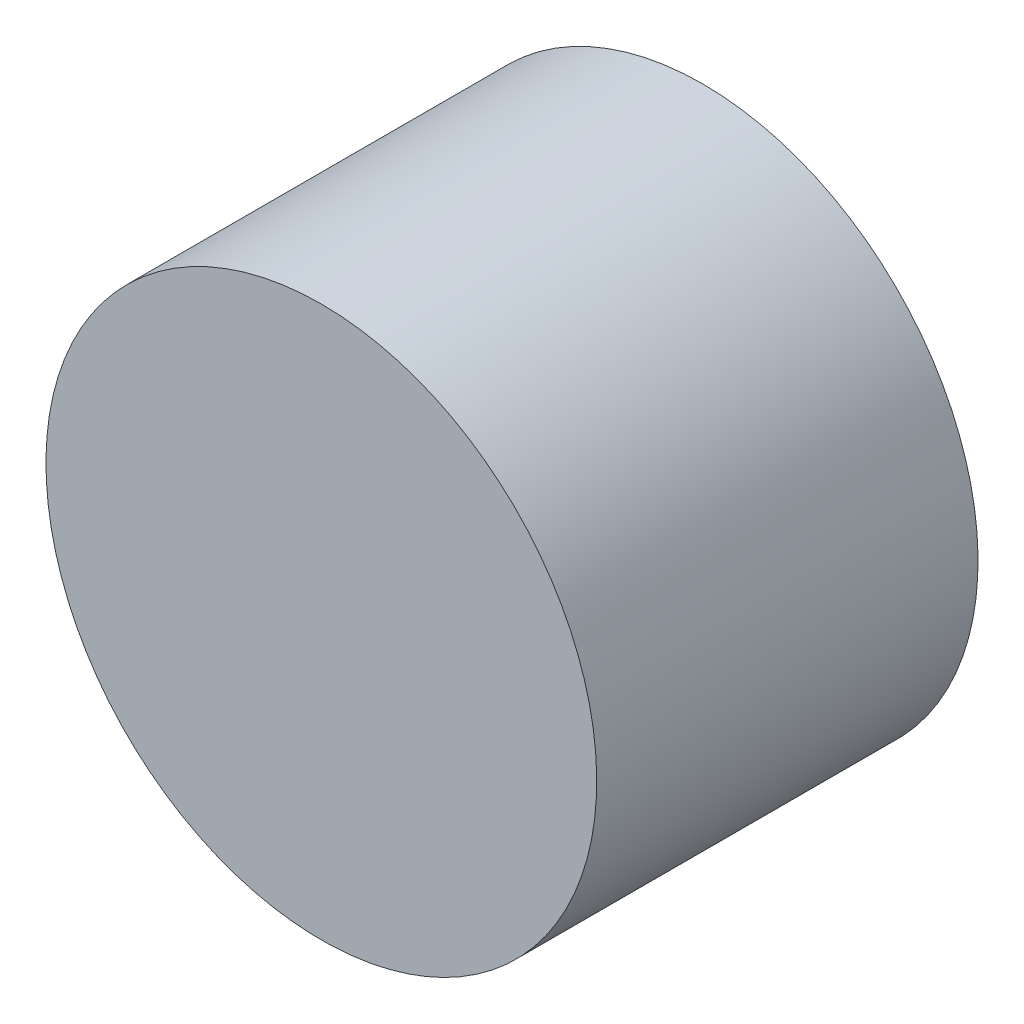
from build123d import *

# Parameters (mm, degrees)
SKETCH1_W = 180
SKETCH1_H = 130


with BuildPart() as part:
    # Sketch1 → Revolve1 (revolve)
    with BuildSketch(Plane(origin=(0, 0, 0), x_dir=(0, 0, -1), z_dir=(1, 0, 0))):
        with Locations((90, 65)):
            Rectangle(SKETCH1_W, SKETCH1_H)
    revolve(axis=Axis((0, 0, -180), (0, 0, 1)))


solid = part.part
